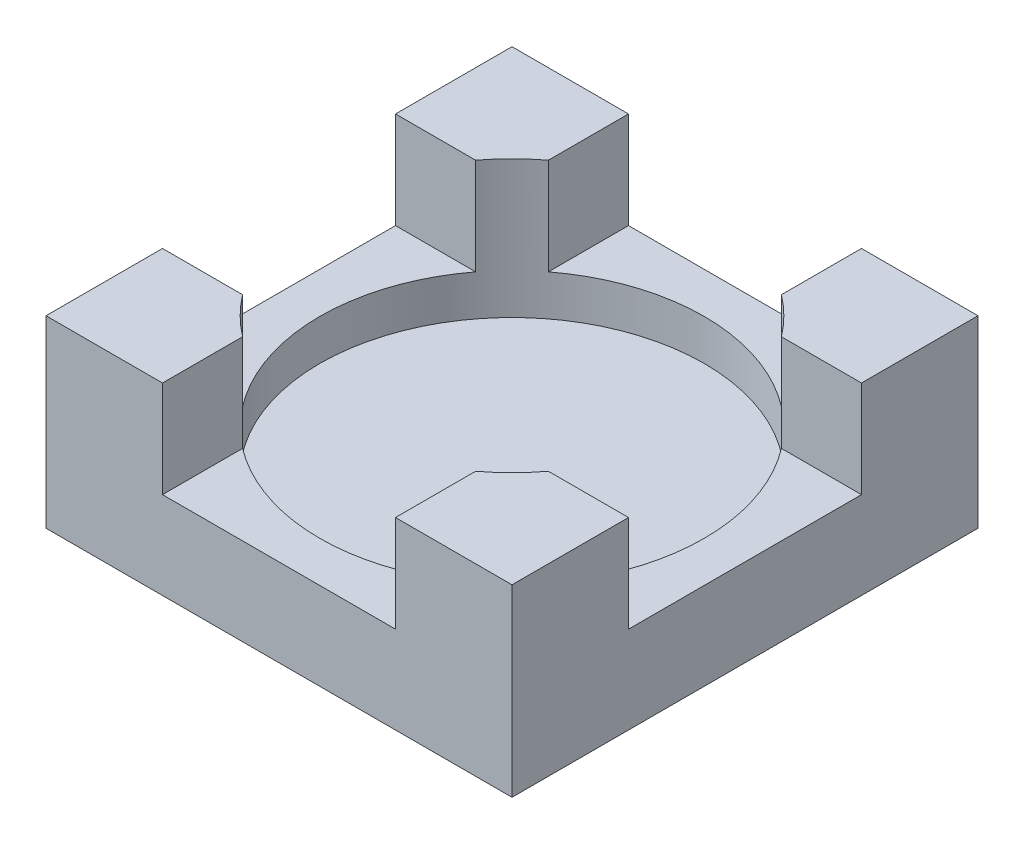
from build123d import *

# Parameters (mm, degrees)
SKETCH1_W           = 40
SKETCH1_H           = 40
BOSS_EXTRUDE1_DEPTH = 90
SKETCH2_R           = 18.5
CUT_EXTRUDE1_DEPTH  = 45
SKETCH3_R           = 16.5
CUT_EXTRUDE2_DEPTH  = 41
SKETCH4_W           = 40
SKETCH4_H           = 40
CUT_EXTRUDE3_DEPTH  = 21
SKETCH6_W           = 20
SKETCH6_H           = 15
CUT_EXTRUDE4_DEPTH  = 83.225300243
SKETCH8_W           = 20
SKETCH8_H           = 15
CUT_EXTRUDE5_DEPTH  = 83.225300243
SKETCH11_W          = 40
SKETCH11_H          = 53.2
CUT_EXTRUDE7_DEPTH  = 83.225300243


with BuildPart() as part:
    # Sketch1 → Boss-Extrude1 (new body)
    with BuildSketch(Plane(origin=(0, 0, 0), x_dir=(1, 0, 0), z_dir=(0, 1, 0))):
        Rectangle(SKETCH1_W, SKETCH1_H)
    extrude(amount=BOSS_EXTRUDE1_DEPTH)

    # Sketch2 → Cut-Extrude1 (cut)
    with BuildSketch(Plane(origin=(0, 90, 0), x_dir=(1, 0, 0), z_dir=(0, 1, 0))):
        with Locations(Location((0, 0, 0), (0, 0, 270))):
            Circle(SKETCH2_R)
    extrude(amount=-CUT_EXTRUDE1_DEPTH, mode=Mode.SUBTRACT)

    # Sketch3 → Cut-Extrude2 (cut)
    with BuildSketch(Plane(origin=(0, 45, 0), x_dir=(1, 0, 0), z_dir=(0, 1, 0))):
        with Locations(Location((0, 0, 0), (0, 0, 270))):
            Circle(SKETCH3_R)
    extrude(amount=-CUT_EXTRUDE2_DEPTH, mode=Mode.SUBTRACT)

    # Sketch4 → Cut-Extrude3 (cut)
    with BuildSketch(Plane(origin=(0, 90, 0), x_dir=(1, 0, 0), z_dir=(0, 1, 0))):
        Rectangle(SKETCH4_W, SKETCH4_H)
    extrude(amount=-CUT_EXTRUDE3_DEPTH, mode=Mode.SUBTRACT)

    # Sketch6 → Cut-Extrude4 (cut, through all)
    with BuildSketch(Plane.XY.offset(20)):
        with Locations((0, 15)):
            Rectangle(SKETCH6_W, SKETCH6_H)
    extrude(amount=-CUT_EXTRUDE4_DEPTH, mode=Mode.SUBTRACT)

    # Sketch8 → Cut-Extrude5 (cut, through all)
    with BuildSketch(Plane.ZY.offset(20)):
        with Locations((0, 15)):
            Rectangle(SKETCH8_W, SKETCH8_H)
    extrude(amount=-CUT_EXTRUDE5_DEPTH, mode=Mode.SUBTRACT)

    # Sketch11 → Cut-Extrude7 (cut, through all)
    with BuildSketch(Plane.XY.offset(20)):
        with Locations((0, 42.4)):
            Rectangle(SKETCH11_W, SKETCH11_H)
    extrude(amount=-CUT_EXTRUDE7_DEPTH, mode=Mode.SUBTRACT)


solid = part.part
